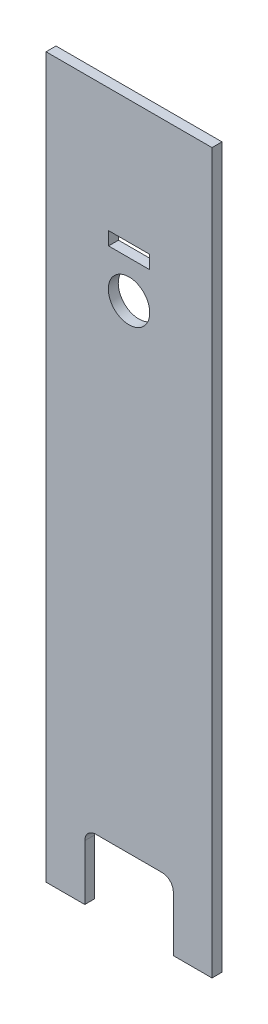
from build123d import *

# Parameters (mm, degrees)
ESBO_O1_W                = 300
ESBO_O1_H                = 1300
RESSALTO_EXTRUS_O1_DEPTH = 18
CORTE_EXTRUS_O1_DEPTH    = 668.326007286
ESBO_O3_R                = 37.5
CORTE_EXTRUS_O2_DEPTH    = 668.326007286
CORTE_EXTRUS_O3_DEPTH    = 668.326007286


with BuildPart() as part:
    # Esboço1 → Ressalto-extrusão1 (new body)
    with BuildSketch(Plane.XY):
        Rectangle(ESBO_O1_W, ESBO_O1_H)
    extrude(amount=RESSALTO_EXTRUS_O1_DEPTH)

    # Esboço2 → Corte-extrusão1 (cut, through all)
    with BuildSketch(Plane(origin=(0, 0, 0), x_dir=(-1, 0, 0), z_dir=(0, 0, -1))):
        with BuildLine():
            Line((-80, -650), (80, -650))
            Line((80, -650), (80, -550))
            ThreePointArc((80, -550), (74.142135624, -535.857864376), (60, -530))
            Line((60, -530), (-60, -530))
            ThreePointArc((-60, -530), (-74.142135624, -535.857864376), (-80, -550))
            Line((-80, -550), (-80, -650))
        make_face()
    extrude(amount=-CORTE_EXTRUS_O1_DEPTH, mode=Mode.SUBTRACT)

    # Esboço3 → Corte-extrusão2 (cut, through all)
    with BuildSketch(Plane(origin=(0, 0, 0), x_dir=(-1, 0, 0), z_dir=(0, 0, -1))):
        with Locations((0, 335)):
            Circle(ESBO_O3_R)
    extrude(amount=-CORTE_EXTRUS_O2_DEPTH, mode=Mode.SUBTRACT)

    # Esboço4 → Corte-extrusão3 (cut, through all)
    with BuildSketch(Plane.XY.offset(18)):
        Polygon((-37, 402.517498316), (37, 402.482501684), (37, 426.517498316), (-37, 426.517498316), align=None)
    extrude(amount=-CORTE_EXTRUS_O3_DEPTH, mode=Mode.SUBTRACT)


solid = part.part
